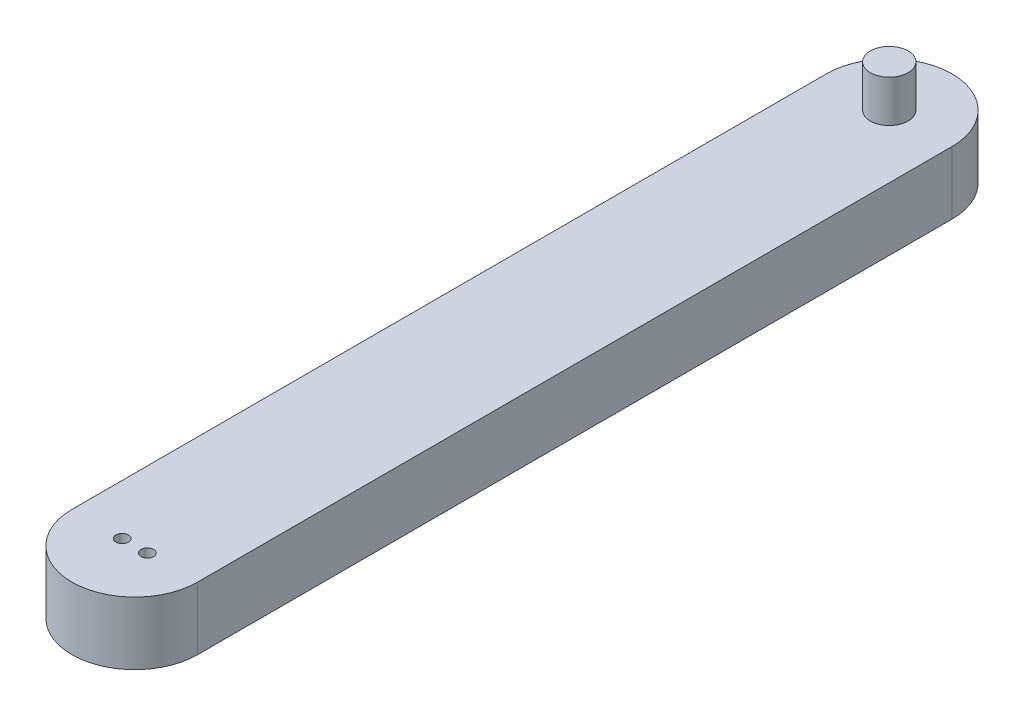
from build123d import *

# Parameters (mm, degrees)
SKETCH2_R           = 0.75
BOSS_EXTRUDE1_DEPTH = 7.5
CUT_EXTRUDE1_DEPTH  = 5
SKETCH4_R           = 2.25
BOSS_EXTRUDE2_DEPTH = 5


with BuildPart() as part:
    # Sketch2 → Boss-Extrude1 (new body)
    with BuildSketch(Plane(origin=(0, 0, 0), x_dir=(1, 0, 0), z_dir=(0, 1, 0))):
        with BuildLine():
            Line((-1.245487365, 94.918772563), (-1.245487365, 4.918772563))
            ThreePointArc((-1.245487365, 4.918772563), (6.254512635, -2.581227437), (13.754512635, 4.918772563))
            Line((13.754512635, 4.918772563), (13.754512635, 94.918772563))
            ThreePointArc((13.754512635, 94.918772563), (6.254512635, 102.418772563), (-1.245487365, 94.918772563))
        make_face()
        with Locations(Location((4.754512635, 4.918772563, 0), (0, 0, 270))):
            Circle(SKETCH2_R, mode=Mode.SUBTRACT)
        with Locations(Location((7.754512635, 4.918772563, 0), (0, 0, 270))):
            Circle(SKETCH2_R, mode=Mode.SUBTRACT)
    extrude(amount=BOSS_EXTRUDE1_DEPTH)

    # Sketch3 → Cut-Extrude1 (cut)
    with BuildSketch(Plane.XZ):
        with BuildLine():
            Line((11.254512635, -4.918772563), (11.254512635, -44.918772563))
            ThreePointArc((11.254512635, -44.918772563), (6.254512635, -49.918772563), (1.254512635, -44.918772563))
            Line((1.254512635, -44.918772563), (1.254512635, -4.918772563))
            ThreePointArc((1.254512635, -4.918772563), (6.254512635, 0.081227437), (11.254512635, -4.918772563))
        make_face()
    extrude(amount=-CUT_EXTRUDE1_DEPTH, mode=Mode.SUBTRACT)

    # Sketch4 → Boss-Extrude2 (add)
    with BuildSketch(Plane(origin=(0, 7.5, 0), x_dir=(1, 0, 0), z_dir=(0, 1, 0))):
        with Locations(Location((6.254512635, 94.918772563, 0), (0, 0, 270))):
            Circle(SKETCH4_R)
    extrude(amount=BOSS_EXTRUDE2_DEPTH)


solid = part.part
